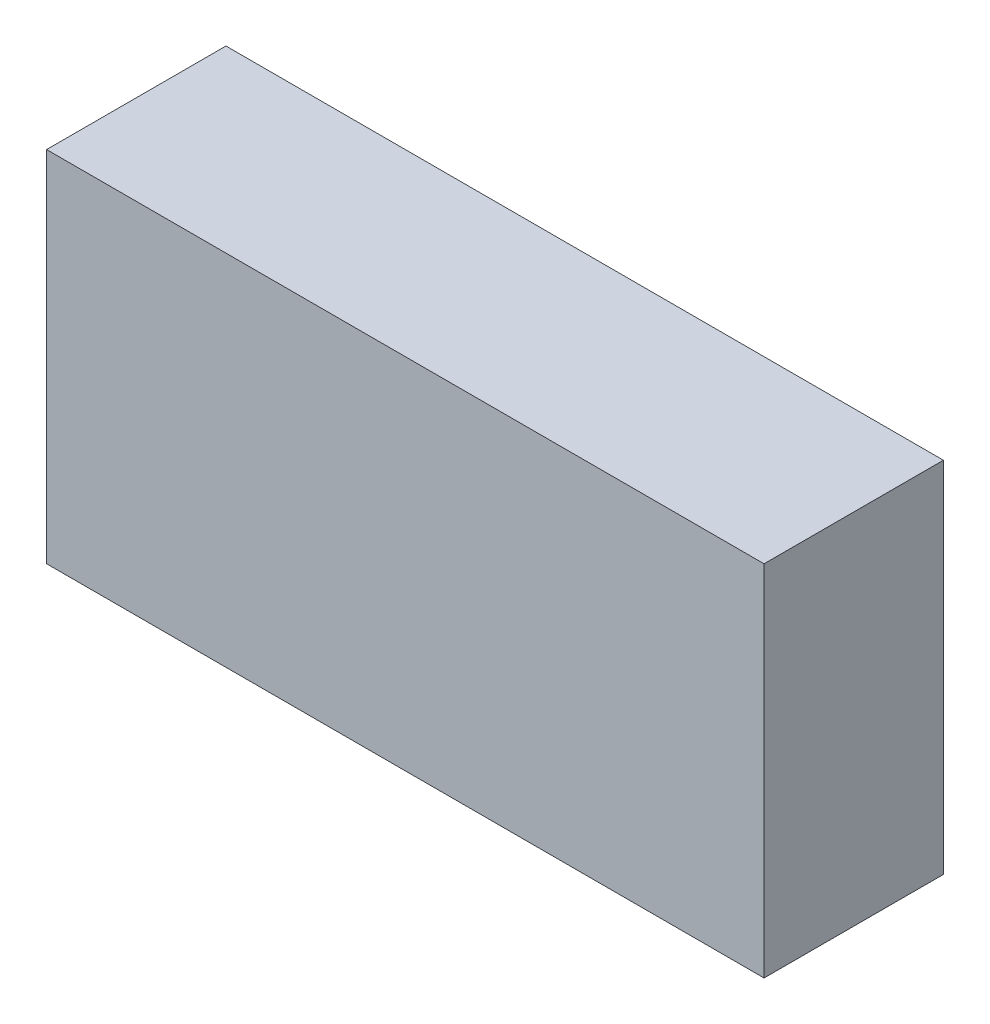
from build123d import *

# Parameters (mm, degrees)
SKETCH1_W           = 40
SKETCH1_H           = 20
BOSS_EXTRUDE1_DEPTH = 10
SKETCH2_W           = 6
SKETCH2_H           = 6
BOSS_EXTRUDE2_DEPTH = 5


with BuildPart() as part:
    # Sketch1 → Boss-Extrude1 (new body)
    with BuildSketch(Plane.XY):
        Rectangle(SKETCH1_W, SKETCH1_H)
    extrude(amount=BOSS_EXTRUDE1_DEPTH)

    # Sketch2 → Boss-Extrude2 (add)
    with BuildSketch(Plane.XY):
        with Locations((-15, -2)):
            Rectangle(SKETCH2_W, SKETCH2_H)
    extrude(amount=BOSS_EXTRUDE2_DEPTH)


solid = part.part
